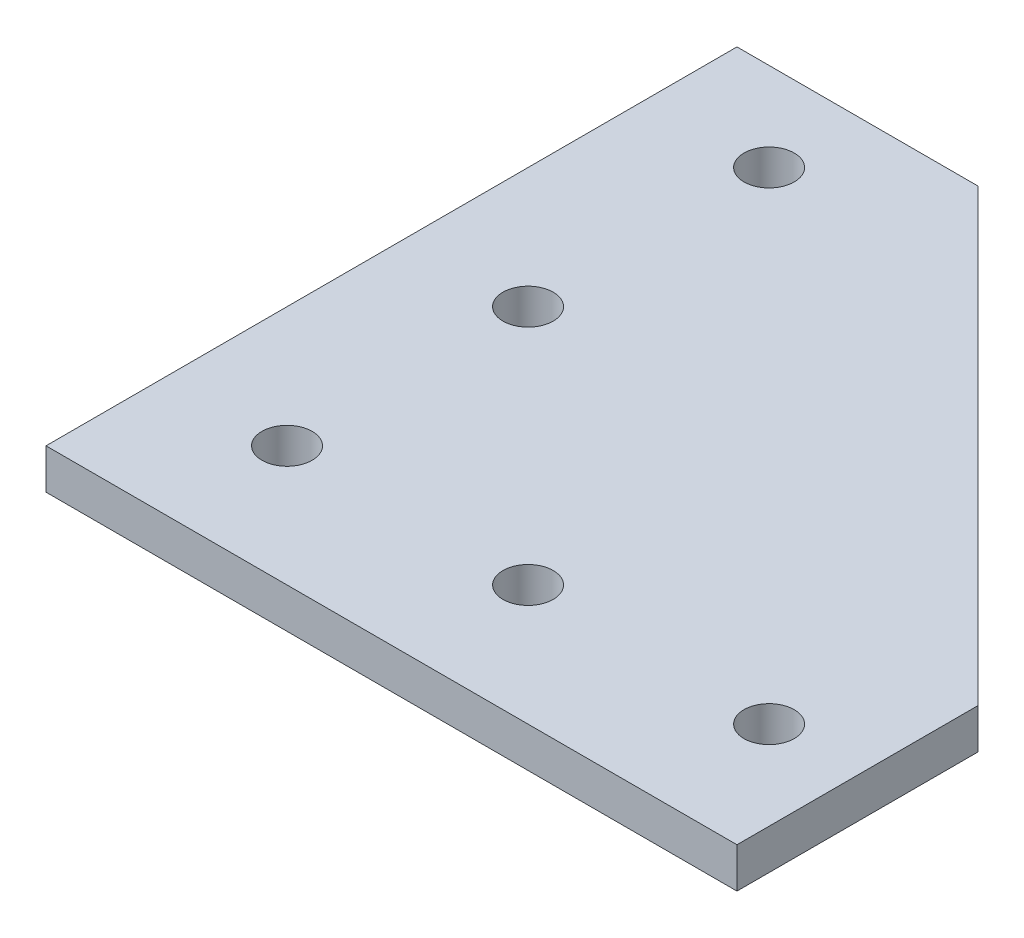
from build123d import *

# Parameters (mm, degrees)
SKETCH1_R           = 3.96875
BOSS_EXTRUDE3_DEPTH = 6.35


with BuildPart() as part:
    # Sketch1 → Boss-Extrude3 (new body)
    with BuildSketch(Plane(origin=(0, 0, 0), x_dir=(1, 0, 0), z_dir=(0, 1, 0))):
        Polygon((-19.05, 90.17), (19.05, 90.17), (90.17, 19.05), (90.17, -19.05), (-19.05, -19.05), align=None)
        with Locations(Location((0, 0, 0), (0, 0, 270))):
            Circle(SKETCH1_R, mode=Mode.SUBTRACT)
        with Locations(Location((38.1, 0, 0), (0, 0, 270))):
            Circle(SKETCH1_R, mode=Mode.SUBTRACT)
        with Locations(Location((76.2, 0, 0), (0, 0, 270))):
            Circle(SKETCH1_R, mode=Mode.SUBTRACT)
        with Locations(Location((0, 38.1, 0), (0, 0, 270))):
            Circle(SKETCH1_R, mode=Mode.SUBTRACT)
        with Locations(Location((0, 76.2, 0), (0, 0, 270))):
            Circle(SKETCH1_R, mode=Mode.SUBTRACT)
    extrude(amount=BOSS_EXTRUDE3_DEPTH)


solid = part.part
